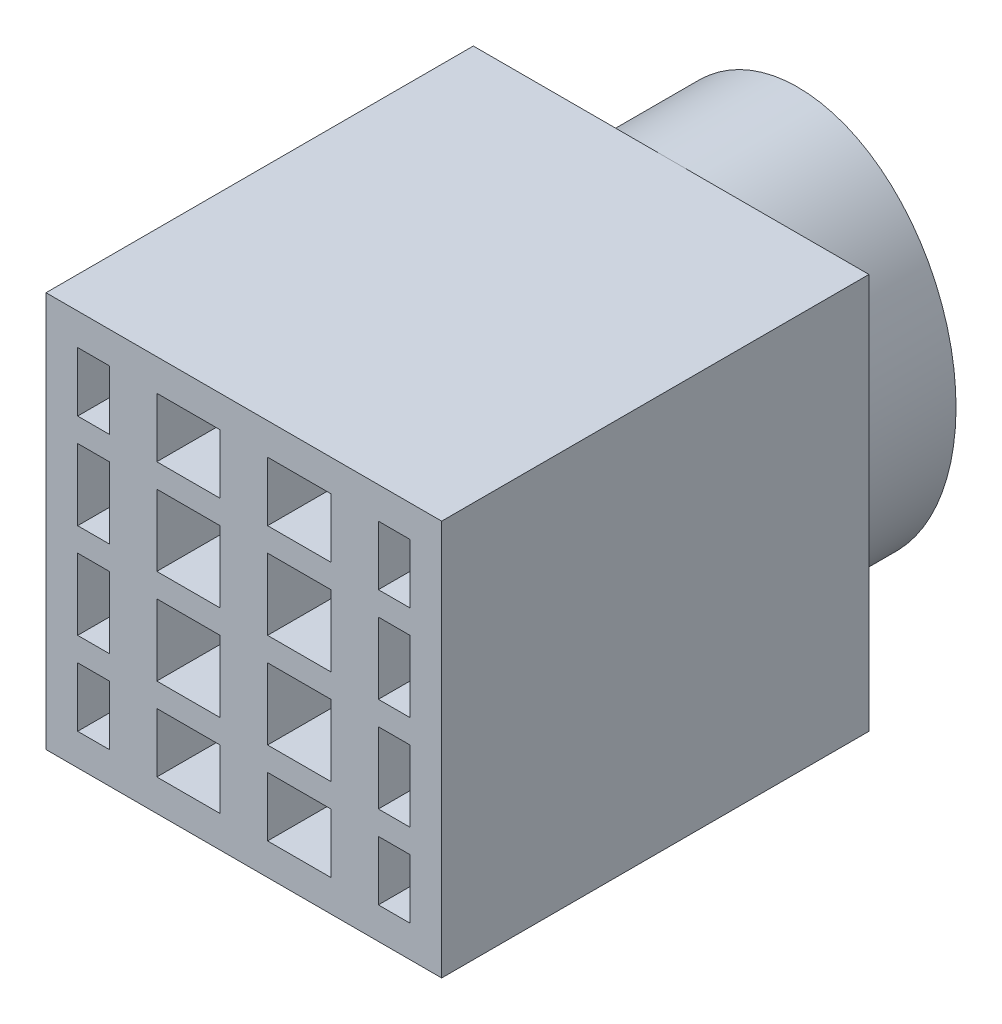
from build123d import *

# Parameters (mm, degrees)
SKETCH_8_W       = 25
SKETCH_8_H       = 25
SKETCH_8_W_2     = 4
SKETCH_8_H_2     = 21
SKETCH_8_W_3     = 2
EXTRUDE_7_DEPTH  = 25
SKETCH_9_W       = 25
SKETCH_9_H       = 25
EXTRUDE_8_DEPTH  = 2
SKETCH_14_W      = 25
SKETCH_14_H      = 1.5
EXTRUDE_11_DEPTH = 25
SKETCH_16_RX     = 12.5
SKETCH_16_RY     = 10
SKETCH_16_RX_2   = 10.5
SKETCH_16_RY_2   = 8
EXTRUDE_14_DEPTH = 6
SKETCH_22_RX     = 12.5
SKETCH_22_RY     = 10
EXTRUDE_18_DEPTH = 2


with BuildPart() as part:
    # 草图8 → 凸台-拉伸7 (new body)
    with BuildSketch(Plane.XY):
        Rectangle(SKETCH_8_W, SKETCH_8_H)
        with Locations((3.5, 0)):
            Rectangle(SKETCH_8_W_2, SKETCH_8_H_2, mode=Mode.SUBTRACT)
        with Locations((-3.5, 0)):
            Rectangle(SKETCH_8_W_2, SKETCH_8_H_2, mode=Mode.SUBTRACT)
        with Locations((-9.5, 0)):
            Rectangle(SKETCH_8_W_3, SKETCH_8_H_2, mode=Mode.SUBTRACT)
        with Locations((9.5, 0)):
            Rectangle(SKETCH_8_W_3, SKETCH_8_H_2, mode=Mode.SUBTRACT)
    extrude(amount=EXTRUDE_7_DEPTH)

    # 草图9 → 凸台-拉伸8 (add)
    with BuildSketch(Plane(origin=(0, 0, 0), x_dir=(-1, 0, 0), z_dir=(0, 0, -1))):
        Rectangle(SKETCH_9_W, SKETCH_9_H)
    extrude(amount=EXTRUDE_8_DEPTH)

    # 草图14 → 凸台-拉伸11 (add)
    with BuildSketch(Plane.XY.offset(25)):
        Rectangle(SKETCH_14_W, SKETCH_14_H)
        with Locations((0, 6)):
            Rectangle(SKETCH_14_W, SKETCH_14_H)
        with Locations((0, -6)):
            Rectangle(SKETCH_14_W, SKETCH_14_H)
    extrude(amount=-EXTRUDE_11_DEPTH)

    # 草图16 → 凸台-拉伸14 (add)
    with BuildSketch(Plane(origin=(0, 0, -2), x_dir=(-1, 0, 0), z_dir=(0, 0, -1))):
        with Locations(Location((0, 0), (0, 0, -90))):
            Ellipse(SKETCH_16_RX, SKETCH_16_RY)
        with Locations(Location((0, 0), (0, 0, -90))):
            Ellipse(SKETCH_16_RX_2, SKETCH_16_RY_2, mode=Mode.SUBTRACT)
    extrude(amount=EXTRUDE_14_DEPTH)

    # 草图22 → 凸台-拉伸18 (add)
    with BuildSketch(Plane(origin=(0, 0, -8), x_dir=(-1, 0, 0), z_dir=(0, 0, -1))):
        with Locations(Location((0, 0), (0, 0, -90))):
            Ellipse(SKETCH_22_RX, SKETCH_22_RY)
    extrude(amount=EXTRUDE_18_DEPTH)


solid = part.part
